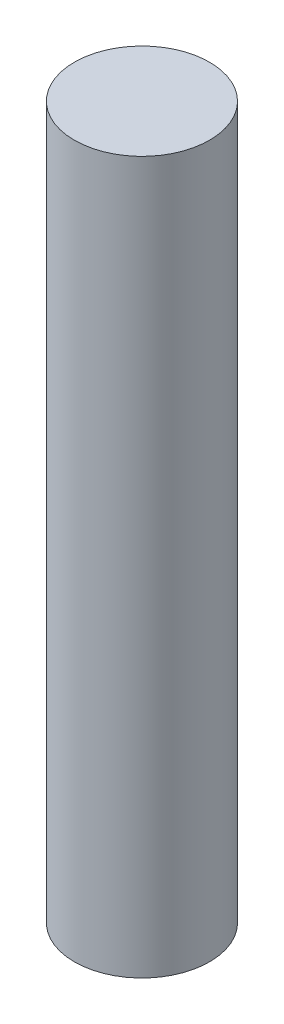
from build123d import *

# Parameters (mm, degrees)
SKETCH1_R           = 2.85
BOSS_EXTRUDE1_DEPTH = 30


with BuildPart() as part:
    # Sketch1 → Boss-Extrude1 (new body)
    with BuildSketch(Plane(origin=(0, 0, 0), x_dir=(1, 0, 0), z_dir=(0, 1, 0))):
        with Locations(Location((0, 0, 0), (0, 0, 270))):
            Circle(SKETCH1_R)
    extrude(amount=BOSS_EXTRUDE1_DEPTH)


solid = part.part
